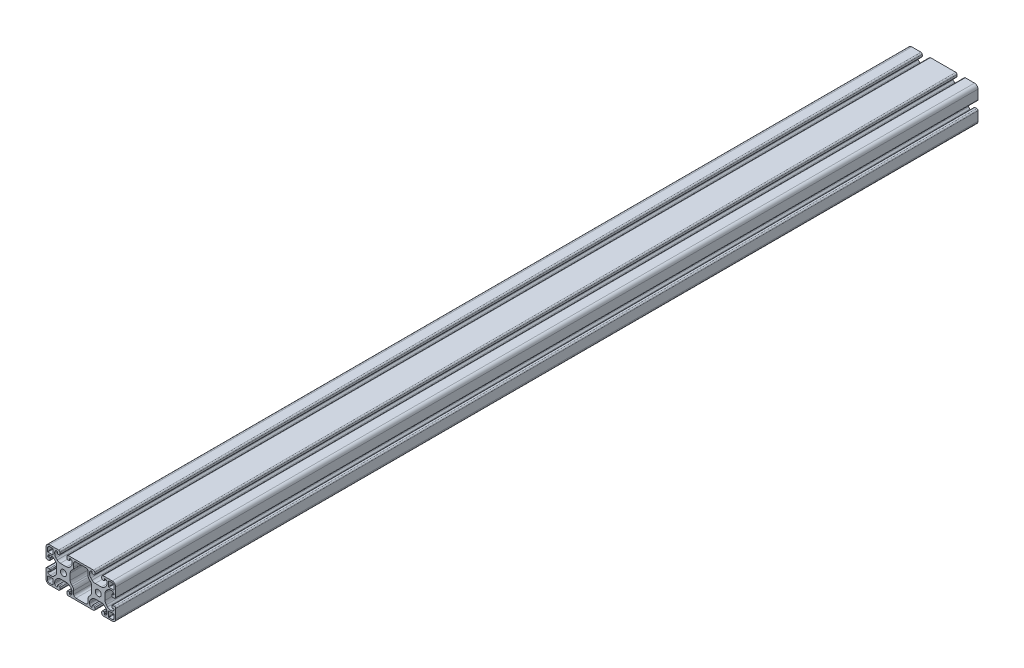
from build123d import *

# Parameters (mm, degrees)
ESQUISSE1_R        = 3.4
BOSS_EXTRU_1_DEPTH = 990


with BuildPart() as part:
    # Esquisse1 → Boss.-Extru.1 (new body)
    with BuildSketch(Plane.XY.offset(20)):
        with BuildLine():
            Line((66.5, 4.5), (65, 4.5))
            ThreePointArc((65, 4.5), (64.292893219, 4.207106781), (64, 3.5))
            Line((64, 3.5), (64, 1.5))
            ThreePointArc((64, 1.5), (64.439339828, 0.439339828), (65.5, 0))
            Line((65.5, 0), (76, 0))
            ThreePointArc((76, 0), (78.828427125, 1.171572875), (80, 4))
            Line((80, 4), (80, 14.5))
            ThreePointArc((80, 14.5), (79.560660172, 15.560660172), (78.5, 16))
            Line((78.5, 16), (76.5, 16))
            ThreePointArc((76.5, 16), (75.792893219, 15.707106781), (75.5, 15))
            Line((75.5, 15), (75.5, 13.5))
            ThreePointArc((75.5, 13.5), (75.646446609, 13.146446609), (76, 13))
            Line((76, 13), (77.5, 13))
            ThreePointArc((77.5, 13), (77.853553391, 12.853553391), (78, 12.5))
            ThreePointArc((78, 12.5), (77.267766953, 10.732233047), (75.5, 10))
            Line((75.5, 10), (74.192388155, 10))
            ThreePointArc((74.192388155, 10), (72.278970994, 10.380602337), (70.656854249, 11.464466094))
            Line((70.656854249, 11.464466094), (69.214466094, 12.906854249))
            ThreePointArc((69.214466094, 12.906854249), (68.130602337, 14.528970994), (67.75, 16.442388155))
            Line((67.75, 16.442388155), (67.75, 23.557611845))
            ThreePointArc((67.75, 23.557611845), (68.130602337, 25.471029006), (69.214466094, 27.093145751))
            Line((69.214466094, 27.093145751), (70.656854249, 28.535533906))
            ThreePointArc((70.656854249, 28.535533906), (72.278970994, 29.619397663), (74.192388155, 30))
            Line((74.192388155, 30), (75.5, 30))
            ThreePointArc((75.5, 30), (77.267766953, 29.267766953), (78, 27.5))
            ThreePointArc((78, 27.5), (77.853553391, 27.146446609), (77.5, 27))
            Line((77.5, 27), (76, 27))
            ThreePointArc((76, 27), (75.646446609, 26.853553391), (75.5, 26.5))
            Line((75.5, 26.5), (75.5, 25))
            ThreePointArc((75.5, 25), (75.792893219, 24.292893219), (76.5, 24))
            Line((76.5, 24), (78.5, 24))
            ThreePointArc((78.5, 24), (79.560660172, 24.439339828), (80, 25.5))
            Line((80, 25.5), (80, 36))
            ThreePointArc((80, 36), (78.828427125, 38.828427125), (76, 40))
            Line((76, 40), (65.5, 40))
            ThreePointArc((65.5, 40), (64.439339828, 39.560660172), (64, 38.5))
            Line((64, 38.5), (64, 36.5))
            ThreePointArc((64, 36.5), (64.292893219, 35.792893219), (65, 35.5))
            Line((65, 35.5), (66.5, 35.5))
            ThreePointArc((66.5, 35.5), (66.853553391, 35.646446609), (67, 36))
            Line((67, 36), (67, 37.5))
            ThreePointArc((67, 37.5), (67.146446609, 37.853553391), (67.5, 38))
            ThreePointArc((67.5, 38), (69.267766953, 37.267766953), (70, 35.5))
            Line((70, 35.5), (70, 34.192388155))
            ThreePointArc((70, 34.192388155), (69.619397663, 32.278970994), (68.535533906, 30.656854249))
            Line((68.535533906, 30.656854249), (67.093145751, 29.214466094))
            ThreePointArc((67.093145751, 29.214466094), (65.471029006, 28.130602337), (63.557611845, 27.75))
            Line((63.557611845, 27.75), (56.442388155, 27.75))
            ThreePointArc((56.442388155, 27.75), (54.528970994, 28.130602337), (52.906854249, 29.214466094))
            Line((52.906854249, 29.214466094), (51.464466094, 30.656854249))
            ThreePointArc((51.464466094, 30.656854249), (50.380602337, 32.278970994), (50, 34.192388155))
            Line((50, 34.192388155), (50, 35.5))
            ThreePointArc((50, 35.5), (50.732233047, 37.267766953), (52.5, 38))
            ThreePointArc((52.5, 38), (52.853553391, 37.853553391), (53, 37.5))
            Line((53, 37.5), (53, 36))
            ThreePointArc((53, 36), (53.146446609, 35.646446609), (53.5, 35.5))
            Line((53.5, 35.5), (55, 35.5))
            ThreePointArc((55, 35.5), (55.707106781, 35.792893219), (56, 36.5))
            Line((56, 36.5), (56, 38.5))
            ThreePointArc((56, 38.5), (55.560660172, 39.560660172), (54.5, 40))
            Line((54.5, 40), (25.5, 40))
            ThreePointArc((25.5, 40), (24.439339828, 39.560660172), (24, 38.5))
            Line((24, 38.5), (24, 36.5))
            ThreePointArc((24, 36.5), (24.292893219, 35.792893219), (25, 35.5))
            Line((25, 35.5), (26.5, 35.5))
            ThreePointArc((26.5, 35.5), (26.853553391, 35.646446609), (27, 36))
            Line((27, 36), (27, 37.5))
            ThreePointArc((27, 37.5), (27.146446609, 37.853553391), (27.5, 38))
            ThreePointArc((27.5, 38), (29.267766953, 37.267766953), (30, 35.5))
            Line((30, 35.5), (30, 34.192388155))
            ThreePointArc((30, 34.192388155), (29.619397663, 32.278970994), (28.535533906, 30.656854249))
            Line((28.535533906, 30.656854249), (27.093145751, 29.214466094))
            ThreePointArc((27.093145751, 29.214466094), (25.471029006, 28.130602337), (23.557611845, 27.75))
            Line((23.557611845, 27.75), (16.442388155, 27.75))
            ThreePointArc((16.442388155, 27.75), (14.528970994, 28.130602337), (12.906854249, 29.214466094))
            Line((12.906854249, 29.214466094), (11.464466094, 30.656854249))
            ThreePointArc((11.464466094, 30.656854249), (10.380602337, 32.278970994), (10, 34.192388155))
            Line((10, 34.192388155), (10, 35.5))
            ThreePointArc((10, 35.5), (10.732233047, 37.267766953), (12.5, 38))
            ThreePointArc((12.5, 38), (12.853553391, 37.853553391), (13, 37.5))
            Line((13, 37.5), (13, 36))
            ThreePointArc((13, 36), (13.146446609, 35.646446609), (13.5, 35.5))
            Line((13.5, 35.5), (15, 35.5))
            ThreePointArc((15, 35.5), (15.707106781, 35.792893219), (16, 36.5))
            Line((16, 36.5), (16, 38.5))
            ThreePointArc((16, 38.5), (15.560660172, 39.560660172), (14.5, 40))
            Line((14.5, 40), (4, 40))
            ThreePointArc((4, 40), (1.171572875, 38.828427125), (0, 36))
            Line((0, 36), (0, 25.5))
            ThreePointArc((0, 25.5), (0.439339828, 24.439339828), (1.5, 24))
            Line((1.5, 24), (3.5, 24))
            ThreePointArc((3.5, 24), (4.207106781, 24.292893219), (4.5, 25))
            Line((4.5, 25), (4.5, 26.5))
            ThreePointArc((4.5, 26.5), (4.353553391, 26.853553391), (4, 27))
            Line((4, 27), (2.5, 27))
            ThreePointArc((2.5, 27), (2.146446609, 27.146446609), (2, 27.5))
            ThreePointArc((2, 27.5), (2.732233047, 29.267766953), (4.5, 30))
            Line((4.5, 30), (5.807611845, 30))
            ThreePointArc((5.807611845, 30), (7.721029006, 29.619397663), (9.343145751, 28.535533906))
            Line((9.343145751, 28.535533906), (10.785533906, 27.093145751))
            ThreePointArc((10.785533906, 27.093145751), (11.869397663, 25.471029006), (12.25, 23.557611845))
            Line((12.25, 23.557611845), (12.25, 16.442388155))
            ThreePointArc((12.25, 16.442388155), (11.869397663, 14.528970994), (10.785533906, 12.906854249))
            Line((10.785533906, 12.906854249), (9.343145751, 11.464466094))
            ThreePointArc((9.343145751, 11.464466094), (7.721029006, 10.380602337), (5.807611845, 10))
            Line((5.807611845, 10), (4.5, 10))
            ThreePointArc((4.5, 10), (2.732233047, 10.732233047), (2, 12.5))
            ThreePointArc((2, 12.5), (2.146446609, 12.853553391), (2.5, 13))
            Line((2.5, 13), (4, 13))
            ThreePointArc((4, 13), (4.353553391, 13.146446609), (4.5, 13.5))
            Line((4.5, 13.5), (4.5, 15))
            ThreePointArc((4.5, 15), (4.207106781, 15.707106781), (3.5, 16))
            Line((3.5, 16), (1.5, 16))
            ThreePointArc((1.5, 16), (0.439339828, 15.560660172), (0, 14.5))
            Line((0, 14.5), (0, 4))
            ThreePointArc((0, 4), (1.171572875, 1.171572875), (4, 0))
            Line((4, 0), (14.5, 0))
            ThreePointArc((14.5, 0), (15.560660172, 0.439339828), (16, 1.5))
            Line((16, 1.5), (16, 3.5))
            ThreePointArc((16, 3.5), (15.707106781, 4.207106781), (15, 4.5))
            Line((15, 4.5), (13.5, 4.5))
            ThreePointArc((13.5, 4.5), (13.146446609, 4.353553391), (13, 4))
            Line((13, 4), (13, 2.5))
            ThreePointArc((13, 2.5), (12.853553391, 2.146446609), (12.5, 2))
            ThreePointArc((12.5, 2), (10.732233047, 2.732233047), (10, 4.5))
            Line((10, 4.5), (10, 5.807611845))
            ThreePointArc((10, 5.807611845), (10.380602337, 7.721029006), (11.464466094, 9.343145751))
            Line((11.464466094, 9.343145751), (12.906854249, 10.785533906))
            ThreePointArc((12.906854249, 10.785533906), (14.528970994, 11.869397663), (16.442388155, 12.25))
            Line((16.442388155, 12.25), (23.557611845, 12.25))
            ThreePointArc((23.557611845, 12.25), (25.471029006, 11.869397663), (27.093145751, 10.785533906))
            Line((27.093145751, 10.785533906), (28.535533906, 9.343145751))
            ThreePointArc((28.535533906, 9.343145751), (29.619397663, 7.721029006), (30, 5.807611845))
            Line((30, 5.807611845), (30, 4.5))
            ThreePointArc((30, 4.5), (29.267766953, 2.732233047), (27.5, 2))
            ThreePointArc((27.5, 2), (27.146446609, 2.146446609), (27, 2.5))
            Line((27, 2.5), (27, 4))
            ThreePointArc((27, 4), (26.853553391, 4.353553391), (26.5, 4.5))
            Line((26.5, 4.5), (25, 4.5))
            ThreePointArc((25, 4.5), (24.292893219, 4.207106781), (24, 3.5))
            Line((24, 3.5), (24, 1.5))
            ThreePointArc((24, 1.5), (24.439339828, 0.439339828), (25.5, 0))
            Line((25.5, 0), (54.5, 0))
            ThreePointArc((54.5, 0), (55.560660172, 0.439339828), (56, 1.5))
            Line((56, 1.5), (56, 3.5))
            ThreePointArc((56, 3.5), (55.707106781, 4.207106781), (55, 4.5))
            Line((55, 4.5), (53.5, 4.5))
            ThreePointArc((53.5, 4.5), (53.146446609, 4.353553391), (53, 4))
            Line((53, 4), (53, 2.5))
            ThreePointArc((53, 2.5), (52.853553391, 2.146446609), (52.5, 2))
            ThreePointArc((52.5, 2), (50.732233047, 2.732233047), (50, 4.5))
            Line((50, 4.5), (50, 5.807611845))
            ThreePointArc((50, 5.807611845), (50.380602337, 7.721029006), (51.464466094, 9.343145751))
            Line((51.464466094, 9.343145751), (52.906854249, 10.785533906))
            ThreePointArc((52.906854249, 10.785533906), (54.528970994, 11.869397663), (56.442388155, 12.25))
            Line((56.442388155, 12.25), (63.557611845, 12.25))
            ThreePointArc((63.557611845, 12.25), (65.471029006, 11.869397663), (67.093145751, 10.785533906))
            Line((67.093145751, 10.785533906), (68.535533906, 9.343145751))
            ThreePointArc((68.535533906, 9.343145751), (69.619397663, 7.721029006), (70, 5.807611845))
            Line((70, 5.807611845), (70, 4.5))
            ThreePointArc((70, 4.5), (69.267766953, 2.732233047), (67.5, 2))
            ThreePointArc((67.5, 2), (67.146446609, 2.146446609), (67, 2.5))
            Line((67, 2.5), (67, 4))
            ThreePointArc((67, 4), (66.853553391, 4.353553391), (66.5, 4.5))
        make_face()
        with Locations(Location((20, 20, 0), (0, 0, 180))):
            Circle(ESQUISSE1_R, mode=Mode.SUBTRACT)
        with Locations(Location((60, 20, 0), (0, 0, 180))):
            Circle(ESQUISSE1_R, mode=Mode.SUBTRACT)
        with BuildLine():
            Line((31.8, 4.5), (31.8, 8.250252532))
            ThreePointArc((31.8, 8.250252532), (31.419397663, 10.163669694), (30.335533906, 11.785786438))
            Line((30.335533906, 11.785786438), (29.214466094, 12.906854249))
            ThreePointArc((29.214466094, 12.906854249), (28.130602337, 14.528970994), (27.75, 16.442388155))
            Line((27.75, 16.442388155), (27.75, 23.557611845))
            ThreePointArc((27.75, 23.557611845), (28.130602337, 25.471029006), (29.214466094, 27.093145751))
            Line((29.214466094, 27.093145751), (30.335533906, 28.214213562))
            ThreePointArc((30.335533906, 28.214213562), (31.419397663, 29.836330306), (31.8, 31.749747468))
            Line((31.8, 31.749747468), (31.8, 35.5))
            ThreePointArc((31.8, 35.5), (32.532233047, 37.267766953), (34.3, 38))
            Line((34.3, 38), (45.7, 38))
            ThreePointArc((45.7, 38), (47.467766953, 37.267766953), (48.2, 35.5))
            Line((48.2, 35.5), (48.2, 31.749747468))
            ThreePointArc((48.2, 31.749747468), (48.580602337, 29.836330306), (49.664466094, 28.214213562))
            Line((49.664466094, 28.214213562), (50.785533906, 27.093145751))
            ThreePointArc((50.785533906, 27.093145751), (51.869397663, 25.471029006), (52.25, 23.557611845))
            Line((52.25, 23.557611845), (52.25, 16.442388155))
            ThreePointArc((52.25, 16.442388155), (51.869397663, 14.528970994), (50.785533906, 12.906854249))
            Line((50.785533906, 12.906854249), (49.664466094, 11.785786438))
            ThreePointArc((49.664466094, 11.785786438), (48.580602337, 10.163669694), (48.2, 8.250252532))
            Line((48.2, 8.250252532), (48.2, 4.5))
            ThreePointArc((48.2, 4.5), (47.467766953, 2.732233047), (45.7, 2))
            Line((45.7, 2), (34.3, 2))
            ThreePointArc((34.3, 2), (32.532233047, 2.732233047), (31.8, 4.5))
        make_face(mode=Mode.SUBTRACT)
        with BuildLine():
            Line((7.7, 1.8), (4, 1.8))
            ThreePointArc((4, 1.8), (2.444365081, 2.444365081), (1.8, 4))
            Line((1.8, 4), (1.8, 7.7))
            ThreePointArc((1.8, 7.7), (1.946446609, 8.053553391), (2.3, 8.2))
            Line((2.3, 8.2), (7.7, 8.2))
            ThreePointArc((7.7, 8.2), (8.053553391, 8.053553391), (8.2, 7.7))
            Line((8.2, 7.7), (8.2, 2.3))
            ThreePointArc((8.2, 2.3), (8.053553391, 1.946446609), (7.7, 1.8))
        make_face(mode=Mode.SUBTRACT)
        with BuildLine():
            Line((72.3, 38.2), (76, 38.2))
            ThreePointArc((76, 38.2), (77.555634919, 37.555634919), (78.2, 36))
            Line((78.2, 36), (78.2, 32.3))
            ThreePointArc((78.2, 32.3), (78.053553391, 31.946446609), (77.7, 31.8))
            Line((77.7, 31.8), (72.3, 31.8))
            ThreePointArc((72.3, 31.8), (71.946446609, 31.946446609), (71.8, 32.3))
            Line((71.8, 32.3), (71.8, 37.7))
            ThreePointArc((71.8, 37.7), (71.946446609, 38.053553391), (72.3, 38.2))
        make_face(mode=Mode.SUBTRACT)
        with BuildLine():
            Line((78.2, 7.7), (78.2, 4))
            ThreePointArc((78.2, 4), (77.555634919, 2.444365081), (76, 1.8))
            Line((76, 1.8), (72.3, 1.8))
            ThreePointArc((72.3, 1.8), (71.946446609, 1.946446609), (71.8, 2.3))
            Line((71.8, 2.3), (71.8, 7.7))
            ThreePointArc((71.8, 7.7), (71.946446609, 8.053553391), (72.3, 8.2))
            Line((72.3, 8.2), (77.7, 8.2))
            ThreePointArc((77.7, 8.2), (78.053553391, 8.053553391), (78.2, 7.7))
        make_face(mode=Mode.SUBTRACT)
        with BuildLine():
            Line((1.8, 32.3), (1.8, 36))
            ThreePointArc((1.8, 36), (2.444365081, 37.555634919), (4, 38.2))
            Line((4, 38.2), (7.7, 38.2))
            ThreePointArc((7.7, 38.2), (8.053553391, 38.053553391), (8.2, 37.7))
            Line((8.2, 37.7), (8.2, 32.3))
            ThreePointArc((8.2, 32.3), (8.053553391, 31.946446609), (7.7, 31.8))
            Line((7.7, 31.8), (2.3, 31.8))
            ThreePointArc((2.3, 31.8), (1.946446609, 31.946446609), (1.8, 32.3))
        make_face(mode=Mode.SUBTRACT)
    extrude(amount=-BOSS_EXTRU_1_DEPTH)


solid = part.part
